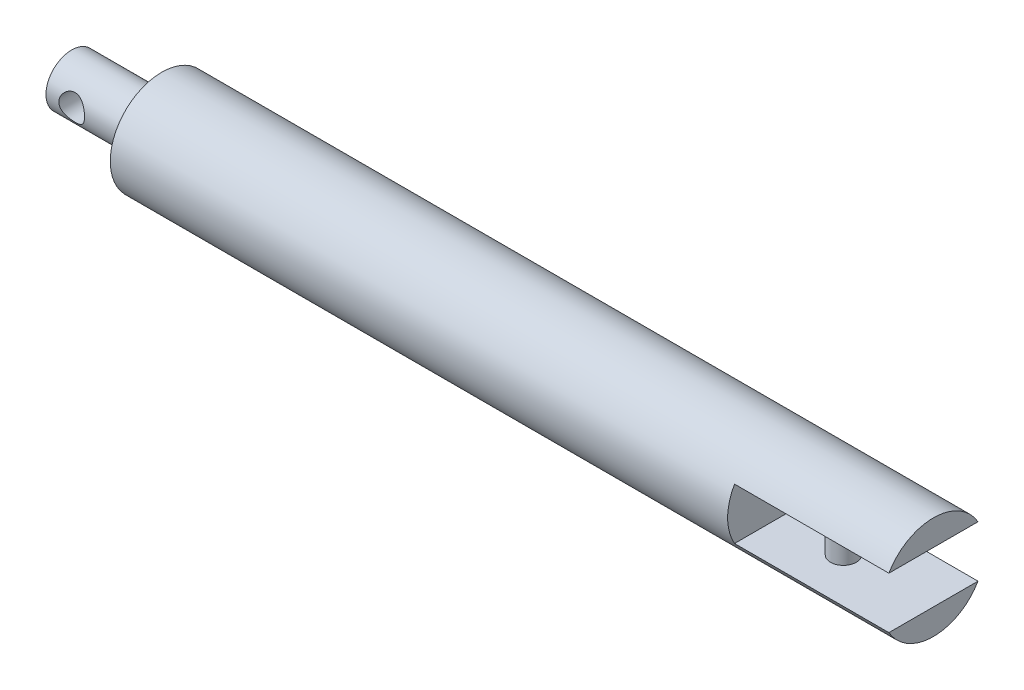
from build123d import *

# Parameters (mm, degrees)
SKETCH1_R           = 2
BOSS_EXTRUDE1_DEPTH = 7
SKETCH2_R           = 1
CUT_EXTRUDE1_DEPTH  = 4
SKETCH3_R           = 4
BOSS_EXTRUDE2_DEPTH = 60
SKETCH4_W           = 8.951999976
SKETCH4_H           = 4
CUT_EXTRUDE2_DEPTH  = 12
SKETCH5_R           = 1
BOSS_EXTRUDE3_DEPTH = 4


with BuildPart() as part:
    # Sketch1 → Boss-Extrude1 (new body)
    with BuildSketch(Plane(origin=(0, 0, 0), x_dir=(0, 0, -1), z_dir=(1, 0, 0))):
        Circle(SKETCH1_R)
    extrude(amount=BOSS_EXTRUDE1_DEPTH)

    # Sketch2 → Cut-Extrude1 (cut)
    with BuildSketch(Plane.XY.offset(2)):
        with Locations((2, 0)):
            Circle(SKETCH2_R)
    extrude(amount=-CUT_EXTRUDE1_DEPTH, mode=Mode.SUBTRACT)

    # Sketch3 → Boss-Extrude2 (add)
    with BuildSketch(Plane(origin=(7, 0, 0), x_dir=(0, 0, -1), z_dir=(1, 0, 0))):
        Circle(SKETCH3_R)
    extrude(amount=BOSS_EXTRUDE2_DEPTH)

    # Sketch4 → Cut-Extrude2 (cut)
    with BuildSketch(Plane(origin=(67, 0, 0), x_dir=(0, 0, -1), z_dir=(1, 0, 0))):
        with Locations((-0.118028397, 0)):
            Rectangle(SKETCH4_W, SKETCH4_H)
    extrude(amount=-CUT_EXTRUDE2_DEPTH, mode=Mode.SUBTRACT)

    # Sketch5 → Boss-Extrude3 (add)
    with BuildSketch(Plane(origin=(0, -2, 0), x_dir=(1, 0, 0), z_dir=(0, 1, 0))):
        with Locations(Location((60, 0, 0), (0, 0, 90))):
            Circle(SKETCH5_R)
    extrude(amount=BOSS_EXTRUDE3_DEPTH)


solid = part.part
